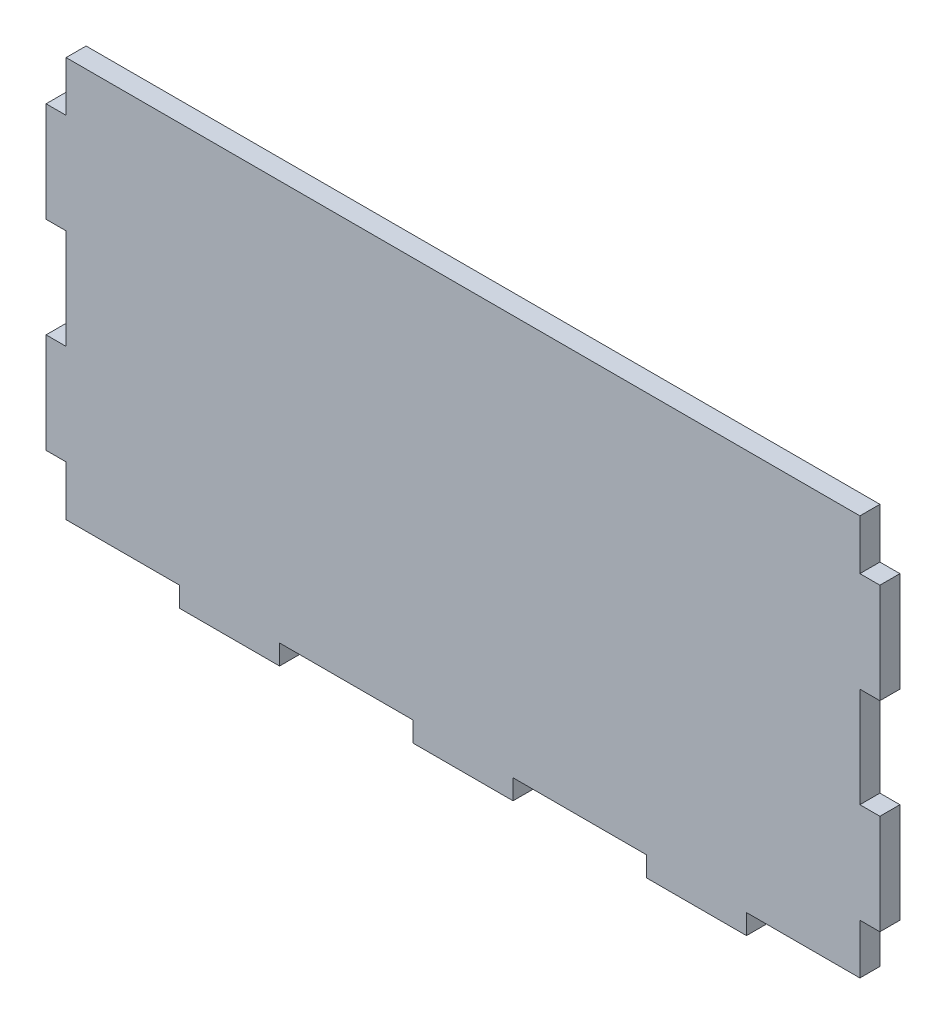
from build123d import *

# Parameters (mm, degrees)
EXTRUDE_1_DEPTH = 6


with BuildPart() as part:
    # Эскиз1 → Бобышка-Вытянуть1 (new body)
    with BuildSketch(Plane.XY):
        Polygon((0, 0), (-238, 0), (-238, -15), (-244, -15), (-244, -45), (-238, -45), (-238, -75), (-244, -75), (-244, -105), (-238, -105), (-238, -120), (-204, -120), (-204, -126), (-174, -126), (-174, -120), (-134, -120), (-134, -126), (-104, -126), (-104, -120), (-64, -120), (-64, -126), (-34, -126), (-34, -120), (0, -120), (0, -105), (6, -105), (6, -75), (0, -75), (0, -45), (6, -45), (6, -15), (0, -15), align=None)
    extrude(amount=EXTRUDE_1_DEPTH)


solid = part.part
